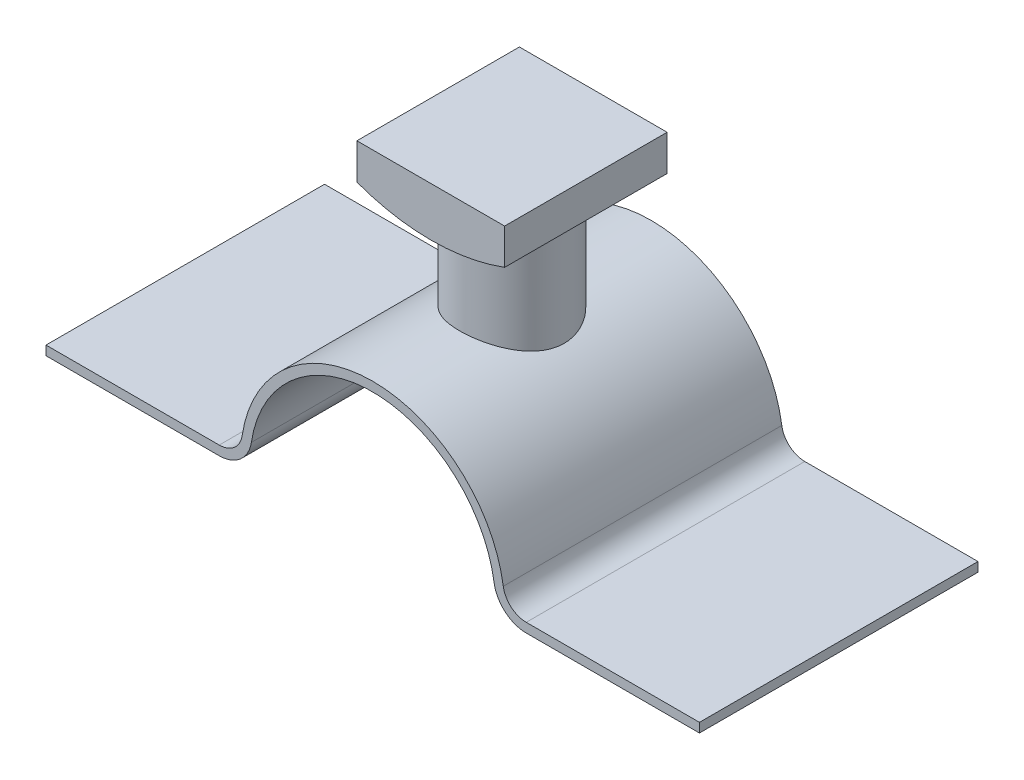
from build123d import *

# Parameters (mm, degrees)
EXTRUDE_THIN1_DEPTH             = 38.1
EXTRUDE1_DEPTH                  = 22.225
EXTRUDE2_REACH                  = 191.48
EXTRUDE2_END_RADIUS             = 58.254302176
SKETCH3_R                       = 14.2875
EXTRUDE2_DIRECTION_2_REACH      = 191.48
EXTRUDE2_DIRECTION_2_END_RADIUS = 36.120408138


with BuildPart() as part:
    # Sketch1 → Extrude-Thin1 (new, symmetric)
    with BuildSketch(Plane.XY):
        with BuildLine():
            Line((0, 0), (47.386965401, 0))
            ThreePointArc((47.386965401, 0), (51.527837673, 1.535887743), (53.665587121, 5.400574229))
            ThreePointArc((53.665587121, 5.400574229), (89.379977527, 36.120408138), (125.094367933, 5.400574229))
            ThreePointArc((125.094367933, 5.400574229), (127.232117381, 1.535887743), (131.372989653, 0))
            Line((131.372989653, 0), (178.759955054, 0))
            Line((178.759955054, 0), (178.759955054, -2.54))
            Line((178.759955054, -2.54), (131.372989653, -2.54))
            ThreePointArc((131.372989653, -2.54), (125.575768472, -0.38975716), (122.582919245, 5.02080392))
            ThreePointArc((122.582919245, 5.02080392), (89.379977527, 33.580408138), (56.177035809, 5.02080392))
            ThreePointArc((56.177035809, 5.02080392), (53.184186582, -0.38975716), (47.386965401, -2.54))
            Line((47.386965401, -2.54), (0, -2.54))
            Line((0, -2.54), (0, 0))
        make_face()
    extrude(amount=EXTRUDE_THIN1_DEPTH, both=True)



with BuildPart() as body_2:
    # Sketch2 → Extrude1 (new, symmetric)
    with BuildSketch(Plane.XY):
        with BuildLine():
            Line((69.175001958, 75.045019307), (109.584953096, 75.045019307))
            Line((109.584953096, 75.045019307), (109.584953096, 65.256940868))
            ThreePointArc((109.584953096, 65.256940868), (89.379977527, 61.640745213), (69.175001958, 65.256940868))
            Line((69.175001958, 65.256940868), (69.175001958, 75.045019307))
        make_face()
    extrude(amount=EXTRUDE1_DEPTH, both=True)


with BuildPart() as part_1:
    add(part.part)

    add(body_2.part)  # Extrude2 merges body 2
    # Extrude2: up to this cylinder (the profile starts outside it)
    extrude2_end = Plane(origin=(89.379977527, 119.89504739, 0), z_dir=(0, 0, -1)) * Cylinder(EXTRUDE2_END_RADIUS, 500.468604353, mode=Mode.PRIVATE)
    # Sketch3 → Extrude2 (add, up to the surface)
    with BuildSketch(Plane(origin=(0, 47.418237056, 0), x_dir=(-1, 0, 0), z_dir=(0, 1, 0)), mode=Mode.PRIVATE) as extrude2_sk1:
        with Locations(Location((-89.379977527, 0, 0), (0, 0, 270))):
            Circle(SKETCH3_R)
    extrude2_tool1 = extrude(extrude2_sk1.sketch, amount=EXTRUDE2_REACH, mode=Mode.PRIVATE) - extrude2_end
    add(extrude2_tool1.solids().sort_by_distance((89.379978, 47.418237, 0))[0])

    # Extrude2 direction 2: up to this cylinder (the profile starts outside it)
    extrude2_direction_2_end = Plane(origin=(89.379977527, 0, 0), z_dir=(0, 0, -1)) * Cylinder(EXTRUDE2_DIRECTION_2_END_RADIUS, 456.200816276, mode=Mode.PRIVATE)
    # Sketch3 → Extrude2 direction 2 (add, up to the surface)
    with BuildSketch(Plane(origin=(0, 47.418237056, 0), x_dir=(-1, 0, 0), z_dir=(0, 1, 0)), mode=Mode.PRIVATE) as extrude2_direction_2_sk1:
        with Locations(Location((-89.379977527, 0, 0), (0, 0, 270))):
            Circle(SKETCH3_R)
    extrude2_direction_2_tool1 = extrude(extrude2_direction_2_sk1.sketch, amount=-EXTRUDE2_DIRECTION_2_REACH, mode=Mode.PRIVATE) - extrude2_direction_2_end
    add(extrude2_direction_2_tool1.solids().sort_by_distance((89.379978, 47.418237, 0))[0])


solid = part_1.part
